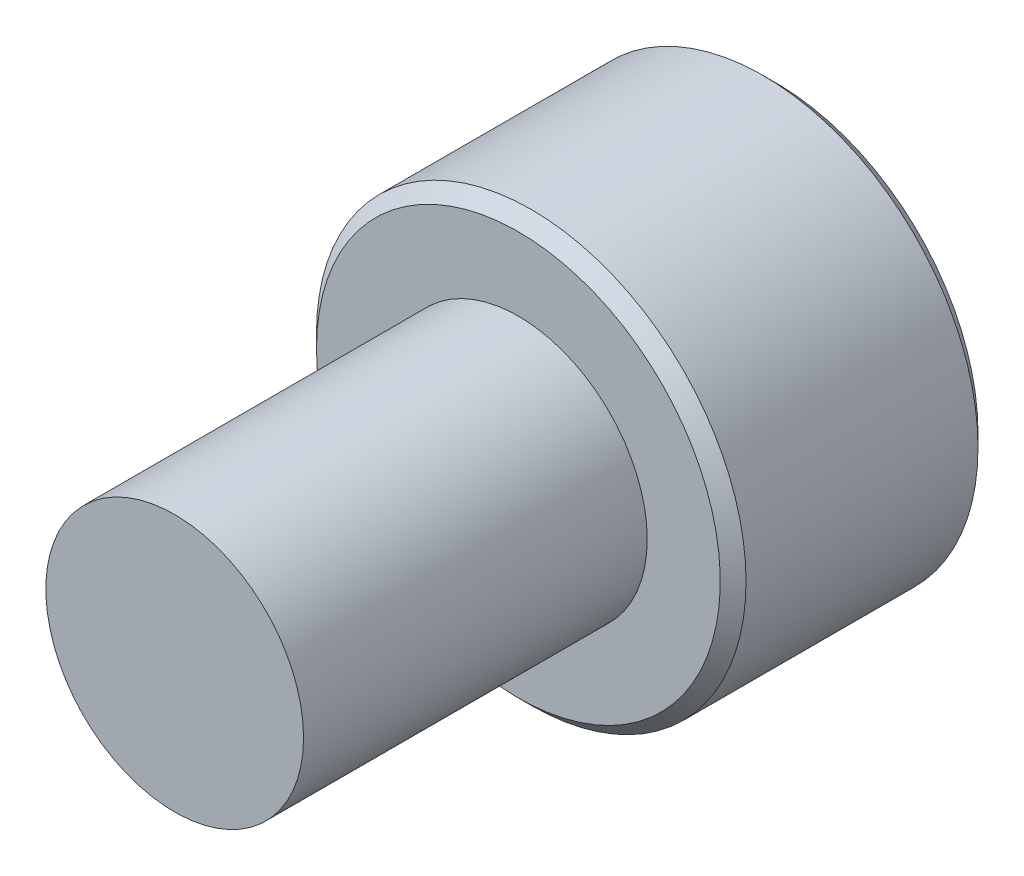
from build123d import *

# Parameters (mm, degrees)
SKETCH1_R          = 3
EXTRUDE1_DEPTH     = 8
SKETCH6_R          = 5
EXTRUDE2_DEPTH     = 6
CUT_EXTRUDE1_DEPTH = 3.75
CHAMFER1_SIZE      = 0.3


with BuildPart() as part:
    # Sketch1 → Extrude1 (new body)
    with BuildSketch(Plane.XY):
        Circle(SKETCH1_R)
    extrude(amount=-EXTRUDE1_DEPTH)

    # Sketch6 → Extrude2 (add)
    with BuildSketch(Plane(origin=(0, 0, -8), x_dir=(-1, 0, 0), z_dir=(0, 0, -1))):
        Circle(SKETCH6_R)
    extrude(amount=EXTRUDE2_DEPTH)

    # Sketch7 → Cut-Extrude1 (cut)
    with BuildSketch(Plane(origin=(0, 0, -14), x_dir=(-1, 0, 0), z_dir=(0, 0, -1))):
        Polygon((0, 2.886751346), (-2.5, 1.443375673), (-2.5, -1.443375673), (0, -2.886751346), (2.5, -1.443375673), (2.5, 1.443375673), align=None)
    extrude(amount=-CUT_EXTRUDE1_DEPTH, mode=Mode.SUBTRACT)

    # Cut-Extrude2 cone 1 section (through the dimple's axis) → Cut-Extrude2 (revolve, cut)
    with BuildSketch(Plane(origin=(0, 0, -14), x_dir=(0, 1, 0), z_dir=(1, 0, 0))):
        Polygon((0, 0), (2.886751346, 0), (0, 2.886751346), align=None)
    revolve(axis=Axis((0, 0, -14), (0, 0, 1)), mode=Mode.SUBTRACT)

    # Chamfer1
    chamfer1_edges = [part.edges().sort_by_distance(p)[0] for p in [
        (5, 0, -8),
        (5, 0, -14),
    ]]
    chamfer(chamfer1_edges, length=CHAMFER1_SIZE)

    # Sketch10 → Revolve1 (revolve)
    with BuildSketch(Plane(origin=(0, 0, 0), x_dir=(0, 0, -1), z_dir=(1, 0, 0)), mode=Mode.PRIVATE) as revolve1_sk:
        Polygon((8, 3), (8, 0), (6.507359313, 0), (7.75, 3), align=None)
    revolve(revolve1_sk.sketch.rotate(Axis((0, 0, -8), (0, 0, 1)), 270), axis=Axis((0, 0, -8), (0, 0, 1)))


solid = part.part
